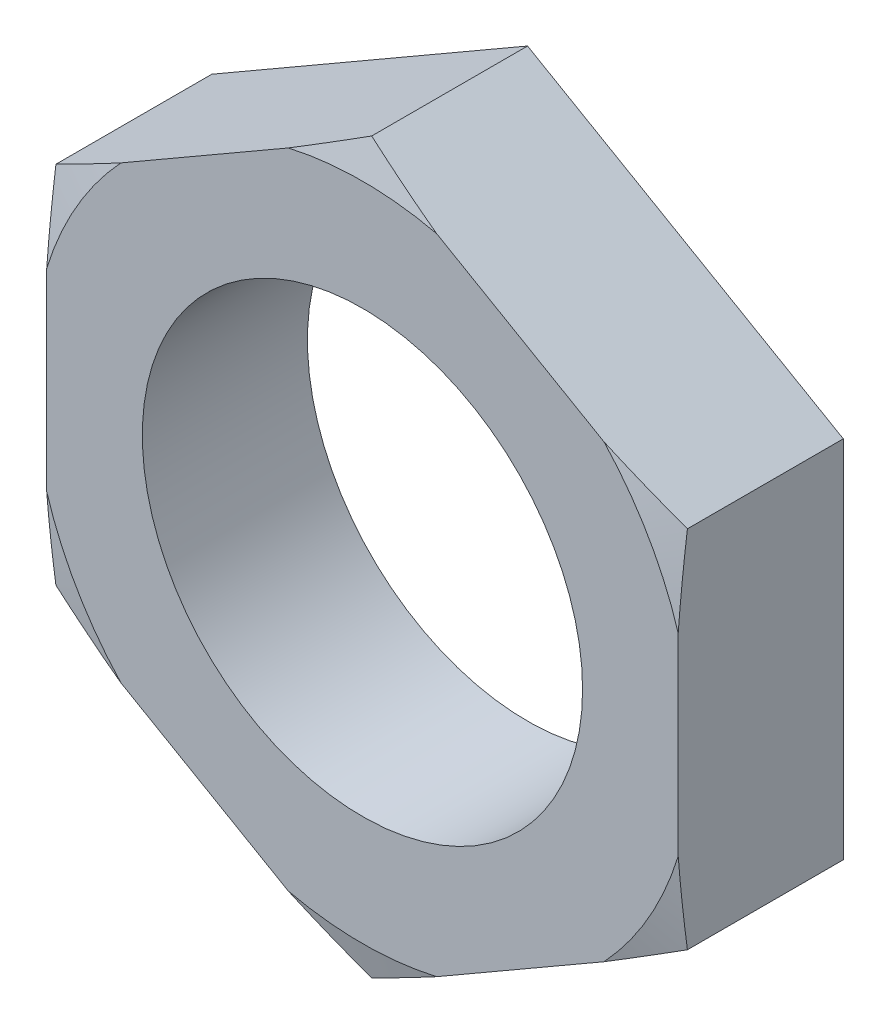
from build123d import *

# Parameters (mm, degrees)
SKETCH_1_R          = 4
EXTRUDE_542_DEPTH   = 3
SKETCH_2_OUTSIDE_W  = 93.636
SKETCH_2_OUTSIDE_H  = 95.412
SKETCH_2_OUTSIDE_R  = 6
CUT_EXTRUDE_1_DEPTH = 10.263292814
CUT_EXTRUDE_1_DRAFT = -75


with BuildPart() as part:
    # 草图1 → Extrude 542 (new body)
    with BuildSketch(Plane.XY):
        Polygon((0, 6.625), (-5.7374183, 3.3125), (-5.7374183, -3.3125), (0, -6.625), (5.7374183, -3.3125), (5.7374183, 3.3125), align=None)
        Circle(SKETCH_1_R, mode=Mode.SUBTRACT)
    extrude(amount=EXTRUDE_542_DEPTH)


with BuildPart() as cut_extrude_1_tool:
    # 草图2 outside → 切除-拉伸1 (with draft: the straight prism first)
    with BuildSketch(Plane.XY.offset(3)):
        Rectangle(SKETCH_2_OUTSIDE_W, SKETCH_2_OUTSIDE_H)
        Circle(SKETCH_2_OUTSIDE_R, mode=Mode.SUBTRACT)
    extrude(amount=-CUT_EXTRUDE_1_DEPTH)
    # 切除-拉伸1: the draft: its side faces are tilted about the plane it starts from
    cut_extrude_1_sides = [cut_extrude_1_tool.faces().sort_by_distance(p)[0] for p in [
        (0, -47.706, -2.131646407),
        (46.818, 0, -2.131646407),
        (0, 47.706, -2.131646407),
        (-46.818, 0, -2.131646407),
        (-6, 0, -2.131646407),
    ]]
    draft(cut_extrude_1_sides, Plane.XY.offset(3), CUT_EXTRUDE_1_DRAFT)


with BuildPart() as part_1:
    add(part.part)

    # 切除-拉伸1: cut by cut_extrude_1_tool
    add(cut_extrude_1_tool.part, mode=Mode.SUBTRACT)


solid = part_1.part
